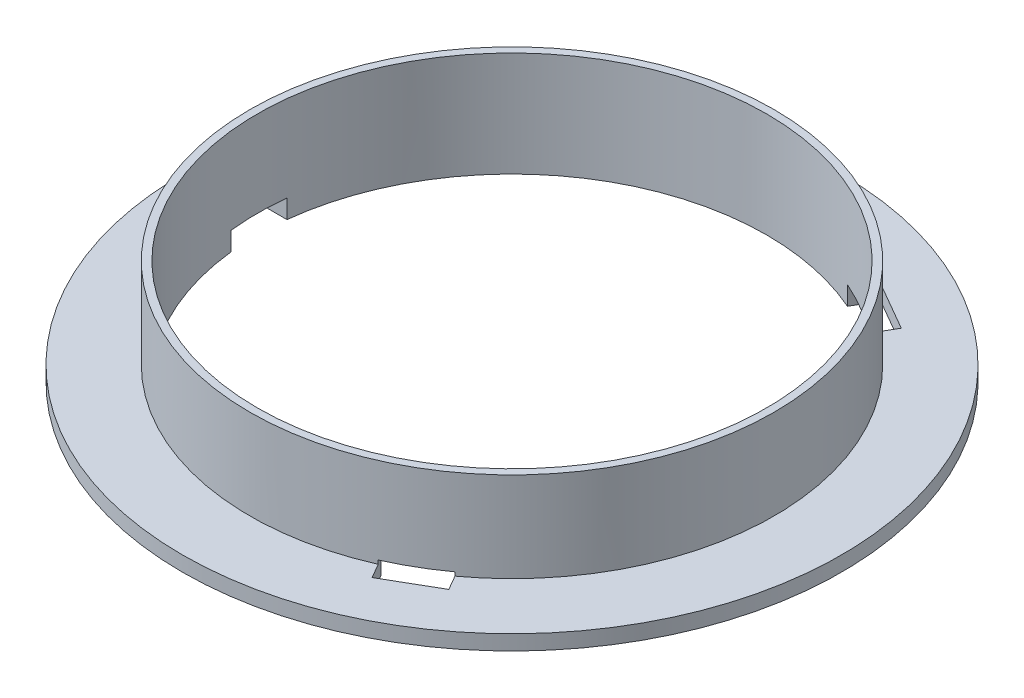
from build123d import *

# Parameters (mm, degrees)
SKETCH5_W          = 3.25
SKETCH5_H          = 7.5
CUT_EXTRUDE1_DEPTH = 2.5


with BuildPart() as part:
    # Sketch2 → Revolve1 (revolve)
    with BuildSketch(Plane(origin=(0, 0, 0), x_dir=(0, 0, -1), z_dir=(1, 0, 0))):
        Polygon((34, 0), (44, 0), (44, 2), (35, 2), (35, 14), (34, 14), align=None)
    revolve(axis=Axis((0, 0, 0), (0, 1, 0)))

    # Sketch5 → Cut-Extrude1 (cut)
    with BuildSketch(Plane(origin=(0, 0, 0), x_dir=(-1, 0, 0), z_dir=(0, -1, 0))):
        Polygon((-15.273687611, -33.954802961), (-21.768878139, -30.204802961), (-20.143878139, -27.390220399), (-13.648687611, -31.140220399), align=None)
        with Locations((35.41756575, 0)):
            Rectangle(SKETCH5_W, SKETCH5_H)
        Polygon((-21.768878139, 30.204802961), (-15.273687611, 33.954802961), (-13.648687611, 31.140220399), (-20.143878139, 27.390220399), align=None)
    extrude(amount=-CUT_EXTRUDE1_DEPTH, mode=Mode.SUBTRACT)


solid = part.part
